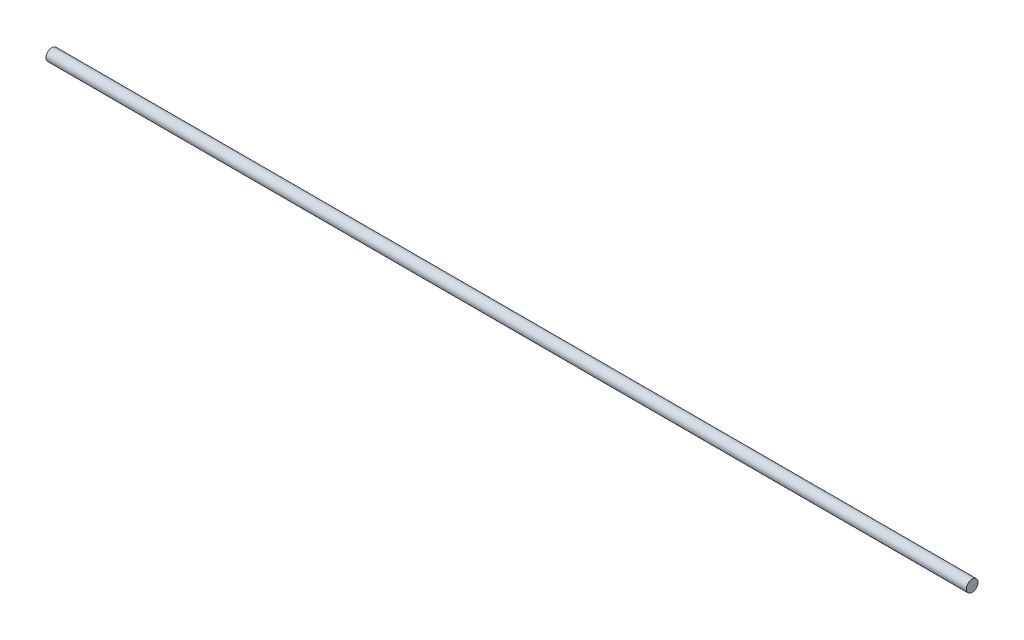
from build123d import *

# Parameters (mm, degrees)
SKETCH1_R           = 5
BOSS_EXTRUDE1_DEPTH = 393


with BuildPart() as part:
    # Sketch1 → Boss-Extrude1 (new, symmetric)
    with BuildSketch(Plane(origin=(0, 0, 0), x_dir=(0, 0, -1), z_dir=(1, 0, 0))):
        Circle(SKETCH1_R)
    extrude(amount=BOSS_EXTRUDE1_DEPTH, both=True)


solid = part.part
